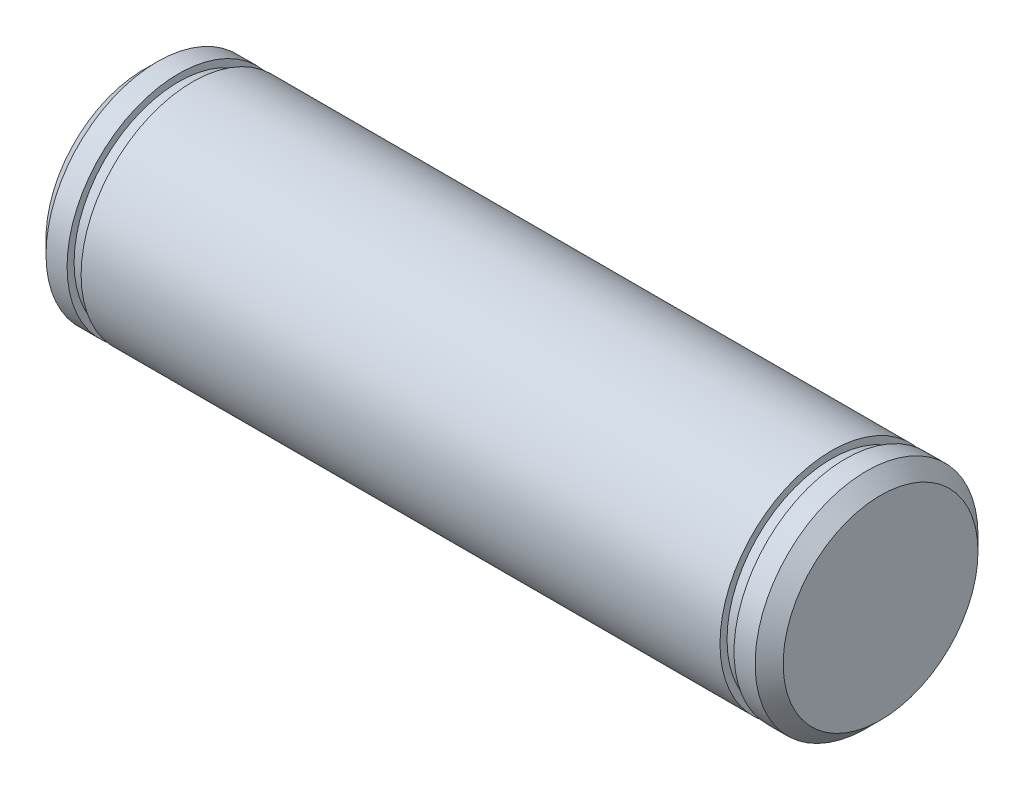
from build123d import *

# Parameters (mm, degrees)
SKETCH2_R           = 15.875
BOSS_EXTRUDE1_DEPTH = 52.5
CHAMFER2_SIZE       = 2
SKETCH4_OUTSIDE_W   = 56.59
SKETCH4_OUTSIDE_H   = 56.59
SKETCH4_OUTSIDE_R   = 14.875
CUT_EXTRUDE5_DEPTH  = 2


with BuildPart() as part:
    # Sketch2 → Boss-Extrude1 (new, symmetric)
    with BuildSketch(Plane(origin=(0, 0, 0), x_dir=(0, 0, -1), z_dir=(1, 0, 0))):
        Circle(SKETCH2_R)
    extrude(amount=BOSS_EXTRUDE1_DEPTH, both=True)

    # Chamfer2
    chamfer2_edges = [part.edges().sort_by_distance(p)[0] for p in [
        (-52.5, 0, 15.875),
        (52.5, 0, 15.875),
    ]]
    chamfer(chamfer2_edges, length=CHAMFER2_SIZE)

    # Sketch4 outside → Cut-Extrude5 (cut)
    with BuildSketch(Plane.ZY.offset(47.5)):
        Rectangle(SKETCH4_OUTSIDE_W, SKETCH4_OUTSIDE_H)
        Circle(SKETCH4_OUTSIDE_R, mode=Mode.SUBTRACT)
    cut_extrude5 = extrude(amount=-CUT_EXTRUDE5_DEPTH, mode=Mode.SUBTRACT)

    # Mirror1: Cut-Extrude5 across plane
    add(cut_extrude5.mirror(Plane(origin=(0, 0, 0), x_dir=(0, 0, 1), z_dir=(1, 0, 0))), mode=Mode.SUBTRACT)


solid = part.part
